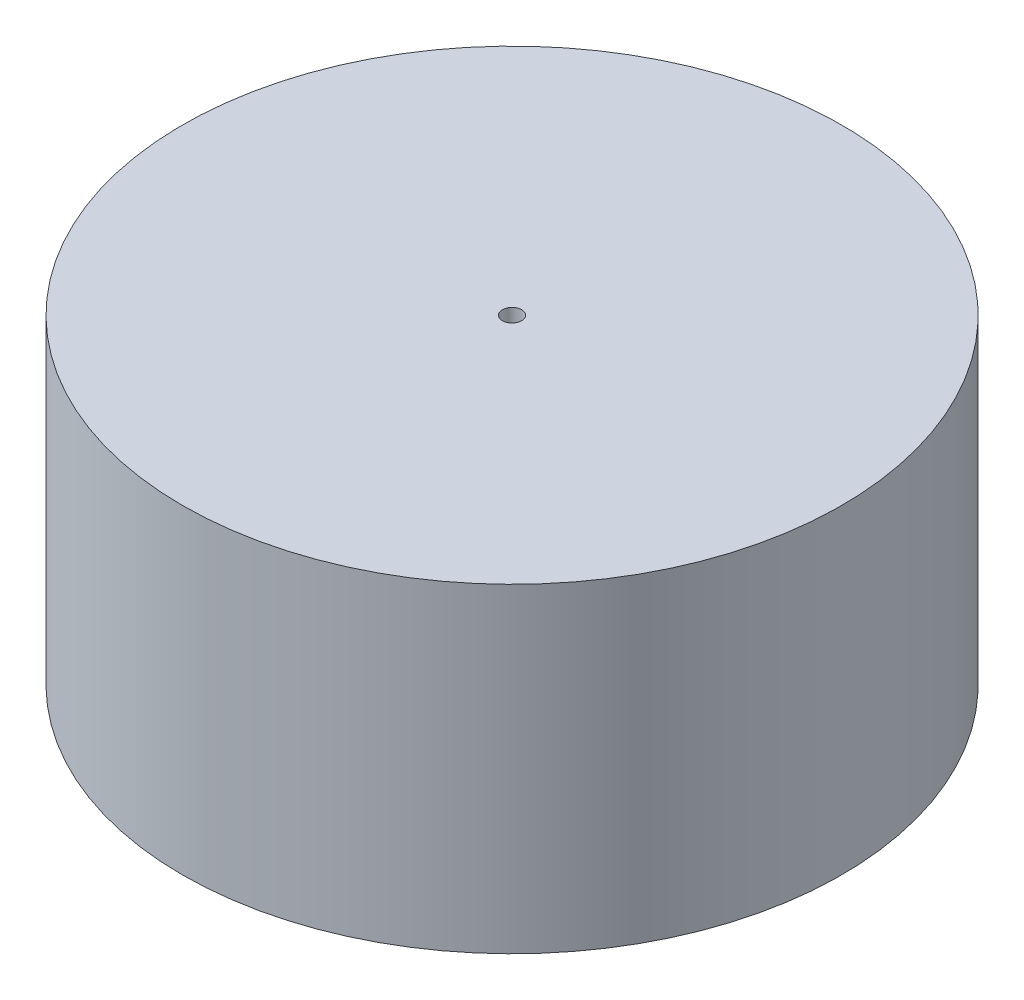
from build123d import *


with BuildPart() as part:
    # Sketch2 → Revolve1 (revolve)
    with BuildSketch(Plane.XY, mode=Mode.PRIVATE) as revolve1_sk:
        with BuildLine():
            Line((0.45, 0.423325242), (0.45, 15.423325242))
            Line((0.45, 15.423325242), (15.45, 15.423325242))
            Line((15.45, 15.423325242), (15.45, 0.423325242))
            Line((15.45, 0.423325242), (2.35, 0.423325242))
            Line((2.35, 0.423325242), (2.35, 1.206680612))
            Line((2.35, 1.206680612), (2.32901869, 3.903053406))
            Line((2.32901869, 3.903053406), (2.32901869, 8.430876594))
            add(Edge.make_bspline(
                [(4.196605338, 10.969687667), (3.922502386, 11.441848149), (2.509035232, 10.990794392), (2.220509348, 9.330364972), (2.32901869, 8.430876594)],
                knots=[0, 0, 0, 0, 0.262564072, 1, 1, 1, 1], degree=3))
            Line((4.196605338, 10.969687667), (4.778131503, 7.236007047))
            ThreePointArc((4.778131503, 7.236007047), (6.500210622, 4.147064861), (9.817375473, 2.920876594))
            Line((9.817375473, 2.920876594), (11.307027571, 2.920876594))
            ThreePointArc((11.307027571, 2.920876594), (11.826873824, 2.945454106), (12.342082499, 3.018967384))
            Line((12.342082499, 3.018967384), (13.489606212, 3.238437081))
            ThreePointArc((13.489606212, 3.238437081), (13.619163994, 3.281851358), (13.732545298, 3.358105526))
            Line((13.732545298, 3.358105526), (13.788115607, 3.407479744))
            ThreePointArc((13.788115607, 3.407479744), (14.308903284, 4.116856602), (14.493292649, 4.977342449))
            Line((14.493292649, 4.977342449), (14.493292649, 9.039992195))
            Line((14.493292649, 9.039992195), (7.825729831, 9.039992195))
            add(Edge.make_bspline(
                [(0.9, 11.277873829), (1.154261749, 13.796749585), (3.412741165, 15.062987228), (6.394883753, 13.664649552), (6.379029002, 12.127449794), (6.776722254, 10.540030851), (6.74201353, 9.221561674), (7.825729831, 9.039992195)],
                knots=[0, 0, 0, 0, 0.440870588, 0.577759513, 0.724851521, 0.783369034, 1, 1, 1, 1], degree=3))
            Line((0.9, 11.277873829), (0.9, 0.423325242))
            Line((0.9, 0.423325242), (0.45, 0.423325242))
        make_face()
    revolve(revolve1_sk.sketch.rotate(Axis((0, 28.78036469, 0), (0, -1, 0)), 90), axis=Axis((0, 28.78036469, 0), (0, -1, 0)))


solid = part.part
